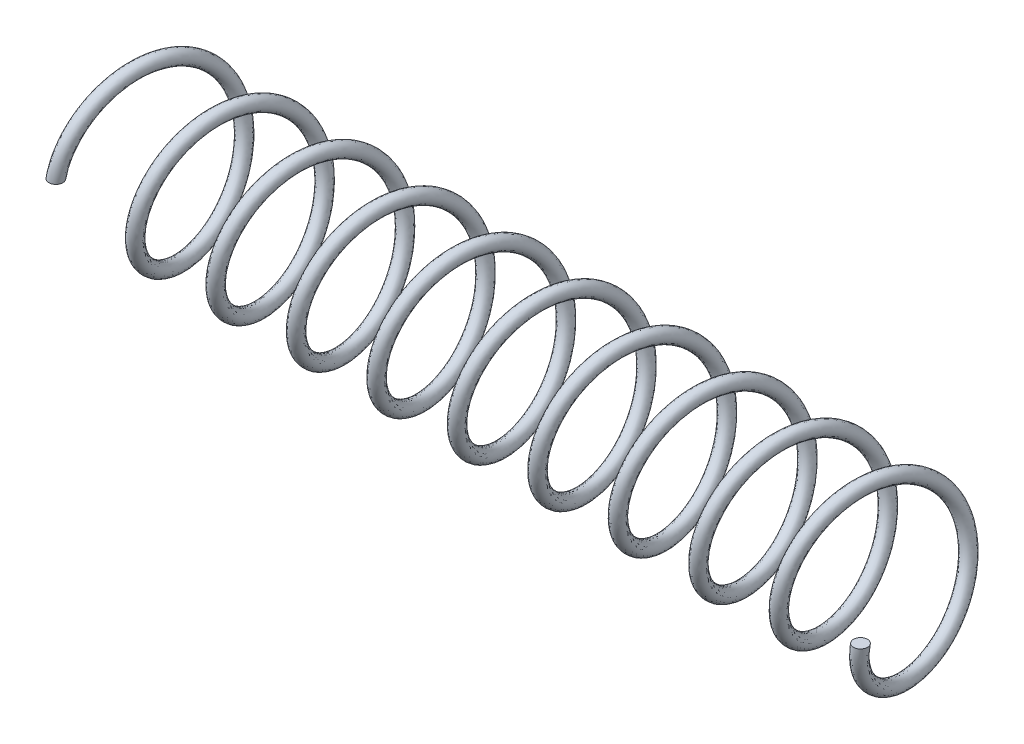
from build123d import *

# Parameters (mm, degrees)
SWEEP1_PITCH  = 2.3
SWEEP1_HEIGHT = 23
SWEEP1_RADIUS = 2.1
SKETCH2_R     = 0.2


with BuildPart() as part:
    # Sweep1: sweep along a helix
    with BuildLine() as sweep1_path:
        Helix(SWEEP1_PITCH, SWEEP1_HEIGHT, SWEEP1_RADIUS, center=(0, 0, 0), direction=(1, 0, 0), lefthand=True)
    # Sketch2 → Sweep1 (sweep)
    with BuildSketch(Plane(origin=(0, 0, 0), x_dir=(1, 0, 0), z_dir=(0, 1, 0))):
        with Locations((0, -2.1)):
            Circle(SKETCH2_R)
    sweep(path=sweep1_path.line, is_frenet=True)


solid = part.part
